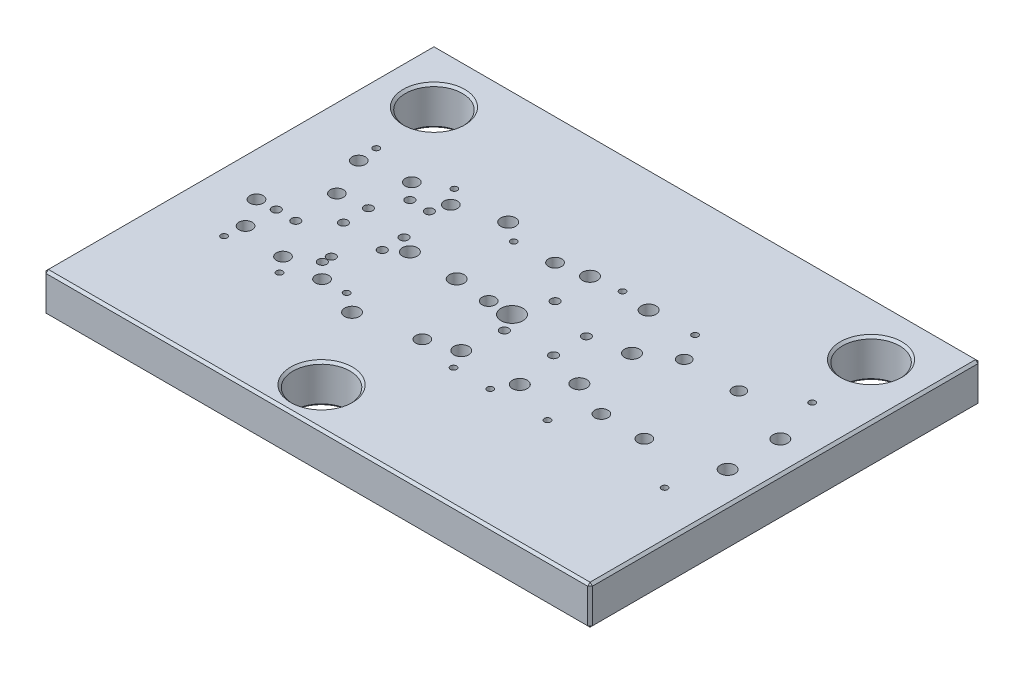
from build123d import *

# Parameters (mm, degrees)
SKETCH1_W                  = 700
SKETCH1_H                  = 500
BOSS_EXTRUDE1_DEPTH        = 50
CUT_EXTRUDE1_REACH         = 435.013
SKETCH2_R                  = 36.5
CHAMFER1_SIZE              = 3
CHAMFER2_SIZE              = 3
M30X2_0_TAPPED_HOLE1_D     = 28
CUT_EXTRUDE2_REACH         = 435.013
SKETCH7_R                  = 6
CUT_EXTRUDE3_REACH         = 435.013
SKETCH8_R                  = 8.5
CUT_EXTRUDE4_REACH         = 435.013
SKETCH9_R                  = 8
SKETCH11_R                 = 9.5
CUT_EXTRUDE5_DEPTH         = 36.8
M10_TAPPED_HOLE1_D         = 8.5
M10_TAPPED_HOLE1_DEPTH     = 27.5
M10_TAPPED_HOLE1_TIP       = 2.553657631
F_8_0MM_DOWEL_HOLE1_D      = 8
M8_TAPPED_HOLE1_D          = 6.8
M8_TAPPED_HOLE1_DEPTH      = 22.25
M8_TAPPED_HOLE1_TIP        = 2.042926105
F_8_0MM_DOWEL_HOLE2_D      = 8
F_11_0_11_DIAMETER_HOLE1_D = 11
SKETCH27_R                 = 6
CUT_EXTRUDE6_DEPTH         = 434.012701892
SKETCH29_R                 = 9.5
CUT_EXTRUDE7_DEPTH         = 36.8
SKETCH30_R                 = 5
CUT_EXTRUDE8_DEPTH         = 434.012701892
SKETCH31_R                 = 8.5
CUT_EXTRUDE9_DEPTH         = 39.8
M8_TAPPED_HOLE2_D          = 6.8
M8_TAPPED_HOLE2_DEPTH      = 22.25
M8_TAPPED_HOLE2_TIP        = 2.042926105
F_8_0MM_DOWEL_HOLE3_D      = 8
SKETCH38_R                 = 6
CUT_EXTRUDE10_DEPTH        = 434.012701892
SKETCH39_R                 = 9.5
CUT_EXTRUDE11_DEPTH        = 36.8
SKETCH40_R                 = 10
CUT_EXTRUDE12_DEPTH        = 9.2
F_10_0_10_DIAMETER_HOLE1_D = 10
SKETCH45_R                 = 8.5
CUT_EXTRUDE13_DEPTH        = 33.8
F_11_0_11_DIAMETER_HOLE2_D = 11
M8_TAPPED_HOLE3_D          = 6.8
M8_TAPPED_HOLE3_DEPTH      = 22.25
M8_TAPPED_HOLE3_TIP        = 2.042926105
F_8_0MM_DOWEL_HOLE4_D      = 8
SKETCH57_R                 = 5
CUT_EXTRUDE14_DEPTH        = 434.012701892
SKETCH58_R                 = 8.5
CUT_EXTRUDE15_DEPTH        = 36.8
F_11_0_11_DIAMETER_HOLE3_D = 11
M8_TAPPED_HOLE4_D          = 6.8
M8_TAPPED_HOLE4_DEPTH      = 22.25
M8_TAPPED_HOLE4_TIP        = 2.042926105
F_8_0MM_DOWEL_HOLE5_D      = 8
M10_TAPPED_HOLE2_D         = 8.5
M10_TAPPED_HOLE2_DEPTH     = 27.5
M10_TAPPED_HOLE2_TIP       = 2.553657631


with BuildPart() as part:
    # Sketch1 → Boss-Extrude1 (new body)
    with BuildSketch(Plane(origin=(0, 0, 0), x_dir=(1, 0, 0), z_dir=(0, 1, 0))):
        Rectangle(SKETCH1_W, SKETCH1_H)
    extrude(amount=-BOSS_EXTRUDE1_DEPTH)

    # Sketch2 → Cut-Extrude1 (cut, up to next)
    with BuildSketch(Plane(origin=(0, 0, 0), x_dir=(1, 0, 0), z_dir=(0, 1, 0)), mode=Mode.PRIVATE) as cut_extrude1_sk1:
        with Locations(Location((-280, 180, 0), (0, 0, 270))):
            Circle(SKETCH2_R)
    cut_extrude1_tool1 = extrude(cut_extrude1_sk1.sketch, amount=-CUT_EXTRUDE1_REACH, mode=Mode.PRIVATE) & part.part
    # Sketch2 → Cut-Extrude1 (cut, up to next)
    with BuildSketch(Plane(origin=(0, 0, 0), x_dir=(1, 0, 0), z_dir=(0, 1, 0)), mode=Mode.PRIVATE) as cut_extrude1_sk2:
        with Locations(Location((280, 180, 0), (0, 0, 270))):
            Circle(SKETCH2_R)
    cut_extrude1_tool2 = extrude(cut_extrude1_sk2.sketch, amount=-CUT_EXTRUDE1_REACH, mode=Mode.PRIVATE) & part.part
    # Sketch2 → Cut-Extrude1 (cut, up to next)
    with BuildSketch(Plane(origin=(0, 0, 0), x_dir=(1, 0, 0), z_dir=(0, 1, 0)), mode=Mode.PRIVATE) as cut_extrude1_sk3:
        with Locations(Location((-44, -200, 0), (0, 0, 270))):
            Circle(SKETCH2_R)
    cut_extrude1_tool3 = extrude(cut_extrude1_sk3.sketch, amount=-CUT_EXTRUDE1_REACH, mode=Mode.PRIVATE) & part.part
    add(cut_extrude1_tool1.solids().sort_by_distance((-280, 0, -180))[0], mode=Mode.SUBTRACT)
    add(cut_extrude1_tool2.solids().sort_by_distance((280, 0, -180))[0], mode=Mode.SUBTRACT)
    add(cut_extrude1_tool3.solids().sort_by_distance((-44, 0, 200))[0], mode=Mode.SUBTRACT)

    # Chamfer1
    chamfer1_edges = [part.edges().sort_by_distance(p)[0] for p in [
        (-280, -50, -216.5),
        (-280, 0, -216.5),
        (280, -50, -216.5),
        (280, 0, -216.5),
        (-44, -50, 163.5),
        (-44, 0, 163.5),
    ]]
    chamfer(chamfer1_edges, length=CHAMFER1_SIZE)

    # Chamfer2
    chamfer2_edges = [part.edges().sort_by_distance(p)[0] for p in [
        (-350, -50, 0),
        (0, -50, 250),
        (350, -50, 0),
        (0, 0, 250),
        (-350, 0, 0),
        (0, 0, -250),
        (350, 0, 0),
        (350, -25, 250),
        (-350, -25, 250),
        (-350, -25, -250),
        (350, -25, -250),
        (0, -50, -250),
    ]]
    chamfer(chamfer2_edges, length=CHAMFER2_SIZE)

    # M30x2.0 Tapped Hole1 (through all)
    with Locations(Plane(origin=(0, 0, 0), x_dir=(1, 0, 0), z_dir=(0, 1, 0))):
        with Locations((0, 0)):
            Hole(M30X2_0_TAPPED_HOLE1_D / 2)

    # Sketch7 → Cut-Extrude2 (cut, up to next)
    with BuildSketch(Plane(origin=(0, 0, 0), x_dir=(1, 0, 0), z_dir=(0, 1, 0)), mode=Mode.PRIVATE) as cut_extrude2_sk1:
        with Locations(Location((310, 33.75, 0), (0, 0, 270))):
            Circle(SKETCH7_R)
    cut_extrude2_tool1 = extrude(cut_extrude2_sk1.sketch, amount=-CUT_EXTRUDE2_REACH, mode=Mode.PRIVATE) & part.part
    # Sketch7 → Cut-Extrude2 (cut, up to next)
    with BuildSketch(Plane(origin=(0, 0, 0), x_dir=(1, 0, 0), z_dir=(0, 1, 0)), mode=Mode.PRIVATE) as cut_extrude2_sk2:
        with Locations(Location((310, -33.75, 0), (0, 0, 270))):
            Circle(SKETCH7_R)
    cut_extrude2_tool2 = extrude(cut_extrude2_sk2.sketch, amount=-CUT_EXTRUDE2_REACH, mode=Mode.PRIVATE) & part.part
    # Sketch7 → Cut-Extrude2 (cut, up to next)
    with BuildSketch(Plane(origin=(0, 0, 0), x_dir=(1, 0, 0), z_dir=(0, 1, 0)), mode=Mode.PRIVATE) as cut_extrude2_sk3:
        with Locations(Location((120, -33.75, 0), (0, 0, 270))):
            Circle(SKETCH7_R)
    cut_extrude2_tool3 = extrude(cut_extrude2_sk3.sketch, amount=-CUT_EXTRUDE2_REACH, mode=Mode.PRIVATE) & part.part
    # Sketch7 → Cut-Extrude2 (cut, up to next)
    with BuildSketch(Plane(origin=(0, 0, 0), x_dir=(1, 0, 0), z_dir=(0, 1, 0)), mode=Mode.PRIVATE) as cut_extrude2_sk4:
        with Locations(Location((120, 33.75, 0), (0, 0, 270))):
            Circle(SKETCH7_R)
    cut_extrude2_tool4 = extrude(cut_extrude2_sk4.sketch, amount=-CUT_EXTRUDE2_REACH, mode=Mode.PRIVATE) & part.part
    add(cut_extrude2_tool1.solids().sort_by_distance((310, 0, -33.75))[0], mode=Mode.SUBTRACT)
    add(cut_extrude2_tool2.solids().sort_by_distance((310, 0, 33.75))[0], mode=Mode.SUBTRACT)
    add(cut_extrude2_tool3.solids().sort_by_distance((120, 0, 33.75))[0], mode=Mode.SUBTRACT)
    add(cut_extrude2_tool4.solids().sort_by_distance((120, 0, -33.75))[0], mode=Mode.SUBTRACT)

    # Sketch8 → Cut-Extrude3 (cut, up to next)
    with BuildSketch(Plane(origin=(0, 0, 0), x_dir=(1, 0, 0), z_dir=(0, 1, 0)), mode=Mode.PRIVATE) as cut_extrude3_sk1:
        with Locations(Location((222.63, -53.14, 0), (0, 0, 270))):
            Circle(SKETCH8_R)
    cut_extrude3_tool1 = extrude(cut_extrude3_sk1.sketch, amount=-CUT_EXTRUDE3_REACH, mode=Mode.PRIVATE) & part.part
    # Sketch8 → Cut-Extrude3 (cut, up to next)
    with BuildSketch(Plane(origin=(0, 0, 0), x_dir=(1, 0, 0), z_dir=(0, 1, 0)), mode=Mode.PRIVATE) as cut_extrude3_sk2:
        with Locations(Location((167.63, -53.14, 0), (0, 0, 270))):
            Circle(SKETCH8_R)
    cut_extrude3_tool2 = extrude(cut_extrude3_sk2.sketch, amount=-CUT_EXTRUDE3_REACH, mode=Mode.PRIVATE) & part.part
    add(cut_extrude3_tool1.solids().sort_by_distance((222.63, 0, 53.14))[0], mode=Mode.SUBTRACT)
    add(cut_extrude3_tool2.solids().sort_by_distance((167.63, 0, 53.14))[0], mode=Mode.SUBTRACT)

    # Sketch9 → Cut-Extrude4 (cut, up to next)
    with BuildSketch(Plane(origin=(0, 0, 0), x_dir=(1, 0, 0), z_dir=(0, 1, 0)), mode=Mode.PRIVATE) as cut_extrude4_sk1:
        with Locations(Location((160.13, 60.5, 0), (0, 0, 270))):
            Circle(SKETCH9_R)
    cut_extrude4_tool1 = extrude(cut_extrude4_sk1.sketch, amount=-CUT_EXTRUDE4_REACH, mode=Mode.PRIVATE) & part.part
    # Sketch9 → Cut-Extrude4 (cut, up to next)
    with BuildSketch(Plane(origin=(0, 0, 0), x_dir=(1, 0, 0), z_dir=(0, 1, 0)), mode=Mode.PRIVATE) as cut_extrude4_sk2:
        with Locations(Location((230.13, 60.5, 0), (0, 0, 270))):
            Circle(SKETCH9_R)
    cut_extrude4_tool2 = extrude(cut_extrude4_sk2.sketch, amount=-CUT_EXTRUDE4_REACH, mode=Mode.PRIVATE) & part.part
    add(cut_extrude4_tool1.solids().sort_by_distance((160.13, 0, -60.5))[0], mode=Mode.SUBTRACT)
    add(cut_extrude4_tool2.solids().sort_by_distance((230.13, 0, -60.5))[0], mode=Mode.SUBTRACT)

    # Sketch11 → Cut-Extrude5 (cut)
    with BuildSketch(Plane(origin=(0, 0, 0), x_dir=(1, 0, 0), z_dir=(0, 1, 0))):
        with Locations(Location((310, -33.75, 0), (0, 0, 270))):
            Circle(SKETCH11_R)
        with Locations(Location((310, 33.75, 0), (0, 0, 270))):
            Circle(SKETCH11_R)
        with Locations(Location((120, -33.75, 0), (0, 0, 270))):
            Circle(SKETCH11_R)
        with Locations(Location((120, 33.75, 0), (0, 0, 270))):
            Circle(SKETCH11_R)
    extrude(amount=-CUT_EXTRUDE5_DEPTH, mode=Mode.SUBTRACT)

    # M10 Tapped Hole1
    with Locations(Plane(origin=(0, -50, 0), x_dir=(-1, 0, 0), z_dir=(0, -1, 0))):
        with Locations((-307, -94.5), (-123, -94.5), (-123, 94.5), (-307, 94.5)):
            Hole(M10_TAPPED_HOLE1_D / 2, depth=M10_TAPPED_HOLE1_DEPTH)
            with Locations((0, 0, -(M10_TAPPED_HOLE1_DEPTH + M10_TAPPED_HOLE1_TIP / 2))):  # 118° drill point
                Cone(0, M10_TAPPED_HOLE1_D / 2, M10_TAPPED_HOLE1_TIP, mode=Mode.SUBTRACT)

    # Ø8.0mm Dowel Hole1 (through all)
    with Locations(Plane(origin=(0, 0, 0), x_dir=(1, 0, 0), z_dir=(0, 1, 0))):
        with Locations((290, 94.5), (140, 94.5), (290, -94.5), (140, -94.5)):
            Hole(F_8_0MM_DOWEL_HOLE1_D / 2)

    # M8 Tapped Hole1
    with Locations(Plane.XZ.offset(50)):
        with Locations((62.13, -96.5), (28.13, -96.5), (84.13, 96.5), (6.13, 96.5)):
            Hole(M8_TAPPED_HOLE1_D / 2, depth=M8_TAPPED_HOLE1_DEPTH)
            with Locations((0, 0, -(M8_TAPPED_HOLE1_DEPTH + M8_TAPPED_HOLE1_TIP / 2))):  # 118° drill point
                Cone(0, M8_TAPPED_HOLE1_D / 2, M8_TAPPED_HOLE1_TIP, mode=Mode.SUBTRACT)

    # Ø8.0mm Dowel Hole2 (through all)
    with Locations(Plane(origin=(0, 0, 0), x_dir=(1, 0, 0), z_dir=(0, 1, 0))):
        with Locations((68.63, -96.5), (21.63, -96.5), (45.13, 96.5)):
            Hole(F_8_0MM_DOWEL_HOLE2_D / 2)

    # Ø11.0 (11) Diameter Hole1 (through all)
    with Locations(Plane(origin=(0, 0, 0), x_dir=(1, 0, 0), z_dir=(0, 1, 0))):
        with Locations((71.88, -18.64), (12.88, -22.64), (71.88, 23.36), (12.88, 42.36)):
            Hole(F_11_0_11_DIAMETER_HOLE1_D / 2)

    # Sketch27 → Cut-Extrude6 (cut, through all)
    with BuildSketch(Plane(origin=(0, 0, 0), x_dir=(1, 0, 0), z_dir=(0, 1, 0))):
        with Locations(Location((7.63, 92.36, 0), (0, 0, 270))):
            Circle(SKETCH27_R)
        with Locations(Location((82.63, 92.36, 0), (0, 0, 270))):
            Circle(SKETCH27_R)
        with Locations(Location((82.63, -72.64, 0), (0, 0, 270))):
            Circle(SKETCH27_R)
        with Locations(Location((7.63, -72.64, 0), (0, 0, 270))):
            Circle(SKETCH27_R)
    extrude(amount=-CUT_EXTRUDE6_DEPTH, mode=Mode.SUBTRACT)

    # Sketch29 → Cut-Extrude7 (cut)
    with BuildSketch(Plane(origin=(0, 0, 0), x_dir=(1, 0, 0), z_dir=(0, 1, 0))):
        with Locations(Location((7.63, 92.36, 0), (0, 0, 270))):
            Circle(SKETCH29_R)
        with Locations(Location((82.63, 92.36, 0), (0, 0, 270))):
            Circle(SKETCH29_R)
        with Locations(Location((7.63, -72.64, 0), (0, 0, 270))):
            Circle(SKETCH29_R)
        with Locations(Location((82.63, -72.64, 0), (0, 0, 270))):
            Circle(SKETCH29_R)
    extrude(amount=-CUT_EXTRUDE7_DEPTH, mode=Mode.SUBTRACT)

    # Sketch30 → Cut-Extrude8 (cut, through all)
    with BuildSketch(Plane(origin=(0, 0, 0), x_dir=(1, 0, 0), z_dir=(0, 1, 0))):
        with Locations(Location((-29.87, 85, 0), (0, 0, 270))):
            Circle(SKETCH30_R)
        with Locations(Location((-29.87, 0, 0), (0, 0, 270))):
            Circle(SKETCH30_R)
        with Locations(Location((-29.87, -85, 0), (0, 0, 270))):
            Circle(SKETCH30_R)
    extrude(amount=-CUT_EXTRUDE8_DEPTH, mode=Mode.SUBTRACT)

    # Sketch31 → Cut-Extrude9 (cut)
    with BuildSketch(Plane(origin=(0, 0, 0), x_dir=(1, 0, 0), z_dir=(0, 1, 0))):
        with Locations(Location((-29.87, 85, 0), (0, 0, 270))):
            Circle(SKETCH31_R)
        with Locations(Location((-29.87, 0, 0), (0, 0, 270))):
            Circle(SKETCH31_R)
        with Locations(Location((-29.87, -85, 0), (0, 0, 270))):
            Circle(SKETCH31_R)
    extrude(amount=-CUT_EXTRUDE9_DEPTH, mode=Mode.SUBTRACT)

    # M8 Tapped Hole2
    with Locations(Plane(origin=(0, -50, 0), x_dir=(-1, 0, 0), z_dir=(0, -1, 0))):
        with Locations((79.87, -97.5), (129.87, -97.5), (79.87, 97.5), (129.87, 97.5)):
            Hole(M8_TAPPED_HOLE2_D / 2, depth=M8_TAPPED_HOLE2_DEPTH)
            with Locations((0, 0, -(M8_TAPPED_HOLE2_DEPTH + M8_TAPPED_HOLE2_TIP / 2))):  # 118° drill point
                Cone(0, M8_TAPPED_HOLE2_D / 2, M8_TAPPED_HOLE2_TIP, mode=Mode.SUBTRACT)

    # Ø8.0mm Dowel Hole3 (through all)
    with Locations(Plane(origin=(0, 0, 0), x_dir=(1, 0, 0), z_dir=(0, 1, 0))):
        with Locations((-79.87, 81.975), (-129.87, -82)):
            Hole(F_8_0MM_DOWEL_HOLE3_D / 2)

    # Sketch38 → Cut-Extrude10 (cut, through all)
    with BuildSketch(Plane(origin=(0, 0, 0), x_dir=(1, 0, 0), z_dir=(0, 1, 0))):
        with Locations(Location((-104.87, 100, 0), (0, 0, 270))):
            Circle(SKETCH38_R)
        with Locations(Location((-104.87, -100, 0), (0, 0, 270))):
            Circle(SKETCH38_R)
        with Locations(Location((-74.87, 4, 0), (0, 0, 270))):
            Circle(SKETCH38_R)
        with Locations(Location((-134.87, 4, 0), (0, 0, 270))):
            Circle(SKETCH38_R)
    extrude(amount=-CUT_EXTRUDE10_DEPTH, mode=Mode.SUBTRACT)

    # Sketch39 → Cut-Extrude11 (cut)
    with BuildSketch(Plane(origin=(0, 0, 0), x_dir=(1, 0, 0), z_dir=(0, 1, 0))):
        with Locations(Location((-104.87, 100, 0), (0, 0, 270))):
            Circle(SKETCH39_R)
        with Locations(Location((-104.87, -100, 0), (0, 0, 270))):
            Circle(SKETCH39_R)
        with Locations(Location((-74.87, 4, 0), (0, 0, 270))):
            Circle(SKETCH39_R)
        with Locations(Location((-134.87, 4, 0), (0, 0, 270))):
            Circle(SKETCH39_R)
    extrude(amount=-CUT_EXTRUDE11_DEPTH, mode=Mode.SUBTRACT)

    # Sketch40 → Cut-Extrude12 (cut)
    with BuildSketch(Plane.XZ.offset(50)):
        with Locations(Location((-185.87, -82.5, 0), (0, 0, 270))):
            Circle(SKETCH40_R)
        with Locations(Location((-210.87, 82.5, 0), (0, 0, 270))):
            Circle(SKETCH40_R)
        with Locations(Location((-185.87, 82.5, 0), (0, 0, 270))):
            Circle(SKETCH40_R)
        with Locations(Location((-160.87, 82.5, 0), (0, 0, 270))):
            Circle(SKETCH40_R)
        with Locations(Location((-160.87, 33, 0), (0, 0, 270))):
            Circle(SKETCH40_R)
        with Locations(Location((-210.87, 33, 0), (0, 0, 270))):
            Circle(SKETCH40_R)
        with Locations(Location((-160.87, -39, 0), (0, 0, 270))):
            Circle(SKETCH40_R)
        with Locations(Location((-160.87, -82.5, 0), (0, 0, 270))):
            Circle(SKETCH40_R)
        with Locations(Location((-210.87, -82.5, 0), (0, 0, 270))):
            Circle(SKETCH40_R)
        with Locations(Location((-210.87, -47, 0), (0, 0, 270))):
            Circle(SKETCH40_R)
    extrude(amount=-CUT_EXTRUDE12_DEPTH, mode=Mode.SUBTRACT)

    # Ø10.0 (10) Diameter Hole1 (through all)
    with Locations(Plane(origin=(0, 0, 0), x_dir=(1, 0, 0), z_dir=(0, 1, 0))):
        with Locations((-160.87, 82.5), (-210.87, 82.5), (-160.87, -82.5), (-210.87, -82.5)):
            Hole(F_10_0_10_DIAMETER_HOLE1_D / 2)

    # Sketch45 → Cut-Extrude13 (cut)
    with BuildSketch(Plane(origin=(0, 0, 0), x_dir=(1, 0, 0), z_dir=(0, 1, 0))):
        with Locations(Location((-160.87, 82.5, 0), (0, 0, 270))):
            Circle(SKETCH45_R)
        with Locations(Location((-210.87, 82.5, 0), (0, 0, 270))):
            Circle(SKETCH45_R)
        with Locations(Location((-160.87, -82.5, 0), (0, 0, 270))):
            Circle(SKETCH45_R)
        with Locations(Location((-210.87, -82.5, 0), (0, 0, 270))):
            Circle(SKETCH45_R)
    extrude(amount=-CUT_EXTRUDE13_DEPTH, mode=Mode.SUBTRACT)

    # Ø11.0 (11) Diameter Hole2 (through all)
    with Locations(Plane(origin=(0, 0, 0), x_dir=(1, 0, 0), z_dir=(0, 1, 0))):
        with Locations((-167.37, 61.5), (-192.37, 61.5), (-154.62, 16.36), (-209.87, 25.86), (-209.87, -6.14), (-179.87, -51.64), (-179.87, -63.14), (-154.62, -11.64)):
            Hole(F_11_0_11_DIAMETER_HOLE2_D / 2)

    # M8 Tapped Hole3
    with Locations(Plane(origin=(0, -50, 0), x_dir=(-1, 0, 0), z_dir=(0, -1, 0))):
        with Locations((160.87, -102.5), (210.87, -102.5), (160.87, 102.5), (210.87, 102.5)):
            Hole(M8_TAPPED_HOLE3_D / 2, depth=M8_TAPPED_HOLE3_DEPTH)
            with Locations((0, 0, -(M8_TAPPED_HOLE3_DEPTH + M8_TAPPED_HOLE3_TIP / 2))):  # 118° drill point
                Cone(0, M8_TAPPED_HOLE3_D / 2, M8_TAPPED_HOLE3_TIP, mode=Mode.SUBTRACT)

    # Ø8.0mm Dowel Hole4 (through all)
    with Locations(Plane(origin=(0, 0, 0), x_dir=(1, 0, 0), z_dir=(0, 1, 0))):
        with Locations((-176.37, 102.5), (-195.37, -102.5)):
            Hole(F_8_0MM_DOWEL_HOLE4_D / 2)

    # Sketch57 → Cut-Extrude14 (cut, through all)
    with BuildSketch(Plane(origin=(0, 0, 0), x_dir=(1, 0, 0), z_dir=(0, 1, 0))):
        with Locations(Location((-268.87, -72.5, 0), (0, 0, 270))):
            Circle(SKETCH57_R)
        with Locations(Location((-291.37, -36, 0), (0, 0, 270))):
            Circle(SKETCH57_R)
        with Locations(Location((-246.37, 22, 0), (0, 0, 270))):
            Circle(SKETCH57_R)
        with Locations(Location((-268.87, 72.5, 0), (0, 0, 270))):
            Circle(SKETCH57_R)
    extrude(amount=-CUT_EXTRUDE14_DEPTH, mode=Mode.SUBTRACT)

    # Sketch58 → Cut-Extrude15 (cut)
    with BuildSketch(Plane(origin=(0, 0, 0), x_dir=(1, 0, 0), z_dir=(0, 1, 0))):
        with Locations(Location((-268.87, 72.5, 0), (0, 0, 270))):
            Circle(SKETCH58_R)
        with Locations(Location((-246.37, 22, 0), (0, 0, 270))):
            Circle(SKETCH58_R)
        with Locations(Location((-291.37, -36, 0), (0, 0, 270))):
            Circle(SKETCH58_R)
        with Locations(Location((-268.87, -72.5, 0), (0, 0, 270))):
            Circle(SKETCH58_R)
    extrude(amount=-CUT_EXTRUDE15_DEPTH, mode=Mode.SUBTRACT)

    # Ø11.0 (11) Diameter Hole3 (through all)
    with Locations(Plane(origin=(0, 0, 0), x_dir=(1, 0, 0), z_dir=(0, 1, 0))):
        with Locations((-267.37, -34.64), (-242.37, -34.64)):
            Hole(F_11_0_11_DIAMETER_HOLE3_D / 2)

    # M8 Tapped Hole4
    with Locations(Plane.XZ.offset(50)):
        with Locations((-291.37, -97.5), (-251.37, -97.5), (-251.37, 97.5), (-291.37, 97.5)):
            Hole(M8_TAPPED_HOLE4_D / 2, depth=M8_TAPPED_HOLE4_DEPTH)
            with Locations((0, 0, -(M8_TAPPED_HOLE4_DEPTH + M8_TAPPED_HOLE4_TIP / 2))):  # 118° drill point
                Cone(0, M8_TAPPED_HOLE4_D / 2, M8_TAPPED_HOLE4_TIP, mode=Mode.SUBTRACT)

    # Ø8.0mm Dowel Hole5 (through all)
    with Locations(Plane(origin=(0, 0, 0), x_dir=(1, 0, 0), z_dir=(0, 1, 0))):
        with Locations((-271.37, -97.5), (-271.37, 97.5)):
            Hole(F_8_0MM_DOWEL_HOLE5_D / 2)

    # M10 Tapped Hole2
    with Locations(Plane(origin=(0, -50, 0), x_dir=(-1, 0, 0), z_dir=(0, -1, 0))):
        with Locations((-300, -190), (190, 190)):
            Hole(M10_TAPPED_HOLE2_D / 2, depth=M10_TAPPED_HOLE2_DEPTH)
            with Locations((0, 0, -(M10_TAPPED_HOLE2_DEPTH + M10_TAPPED_HOLE2_TIP / 2))):  # 118° drill point
                Cone(0, M10_TAPPED_HOLE2_D / 2, M10_TAPPED_HOLE2_TIP, mode=Mode.SUBTRACT)


solid = part.part
